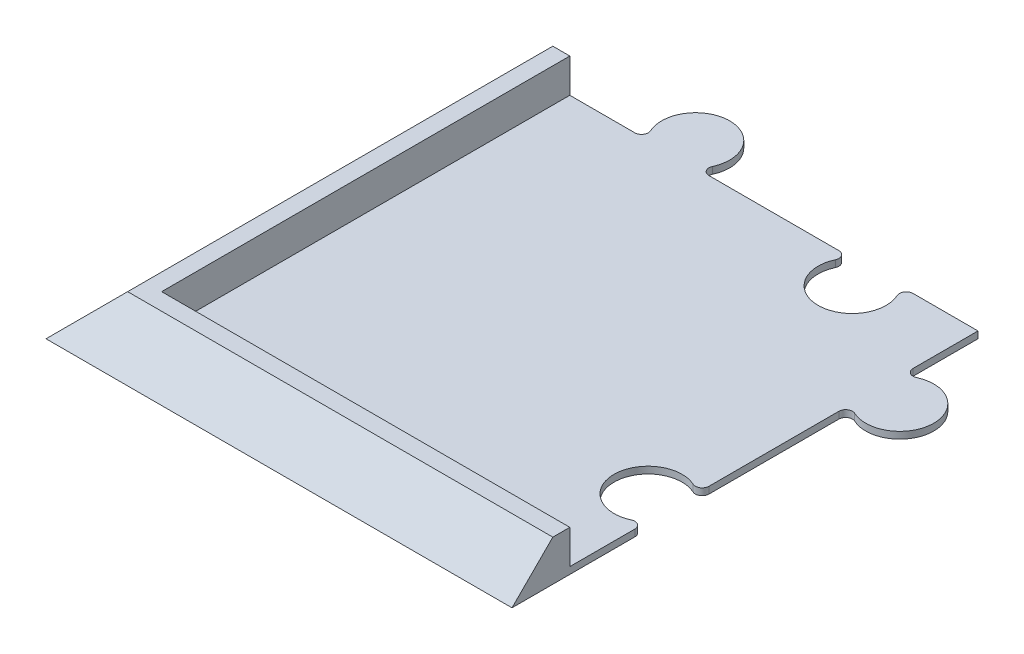
from build123d import *

# Parameters (mm, degrees)
BOSS_EXTRUDE1_DEPTH = 152.4
BOSS_EXTRUDE2_DEPTH = 173.99
CUT_EXTRUDE1_DEPTH  = 232.798485112
BOSS_EXTRUDE3_DEPTH = 2.54
CUT_EXTRUDE2_DEPTH  = 247.386546305
FILLET1_R           = 2.54


with BuildPart() as part:
    # Sketch1 → Boss-Extrude1 (new body)
    with BuildSketch(Plane.XY):
        Polygon((0, 0), (-173.99, 0), (-158.75, 15.24), (-152.4, 15.24), (-152.4, 2.54), (0, 2.54), align=None)
    extrude(amount=BOSS_EXTRUDE1_DEPTH)

    # Sketch2 → Boss-Extrude2 (add, through all)
    with BuildSketch(Plane(origin=(0, 0, 0), x_dir=(0, 0, -1), z_dir=(1, 0, 0))):
        Polygon((-152.4, 2.54), (-152.4, 15.24), (-158.75, 15.24), (-173.99, 0), (-152.4, 0), align=None)
    extrude(amount=-BOSS_EXTRUDE2_DEPTH)

    # Sketch3 → Cut-Extrude1 (cut, through all)
    with BuildSketch(Plane(origin=(0, 0, 152.4), x_dir=(-1, 0, 0), z_dir=(0, 0, -1))):
        Polygon((158.75, 15.24), (173.99, 0), (173.99, 15.24), align=None)
    extrude(amount=-CUT_EXTRUDE1_DEPTH, mode=Mode.SUBTRACT)

    # Sketch4 → Boss-Extrude3 (add, through all)
    with BuildSketch(Plane(origin=(0, 2.54, 0), x_dir=(1, 0, 0), z_dir=(0, 1, 0))):
        with BuildLine():
            ThreePointArc((-105.230385896, 0), (-114.3, 21.59), (-123.369614104, 0))
            Line((-123.369614104, 0), (-105.230385896, 0))
        make_face()
        with BuildLine():
            ThreePointArc((0, -47.169614104), (21.59, -38.1), (0, -29.030385896))
            Line((0, -29.030385896), (0, -47.169614104))
        make_face()
    extrude(amount=-BOSS_EXTRUDE3_DEPTH)

    # Sketch4<3> → Cut-Extrude2 (cut, through all)
    with BuildSketch(Plane(origin=(0, 2.54, 0), x_dir=(1, 0, 0), z_dir=(0, 1, 0))):
        with BuildLine():
            Line((-29.030385896, 0), (-47.169614104, 0))
            ThreePointArc((-47.169614104, 0), (-38.1, -21.59), (-29.030385896, 0))
        make_face()
        with BuildLine():
            Line((0, -123.369614104), (0, -105.230385896))
            ThreePointArc((0, -105.230385896), (-21.59, -114.3), (0, -123.369614104))
        make_face()
    extrude(amount=-CUT_EXTRUDE2_DEPTH, mode=Mode.SUBTRACT)

    # Fillet1
    fillet1_edges = [part.edges().sort_by_distance(p)[0] for p in [
        (-123.369614104, 1.27, 0),
        (-105.230385896, 1.27, 0),
        (0, 1.27, 29.030385896),
        (0, 1.27, 47.169614104),
        (-47.169614104, 1.27, 0),
        (-29.030385896, 1.27, 0),
        (0, 1.27, 105.230385896),
        (0, 1.27, 123.369614104),
    ]]
    fillet(fillet1_edges, radius=FILLET1_R)


solid = part.part
